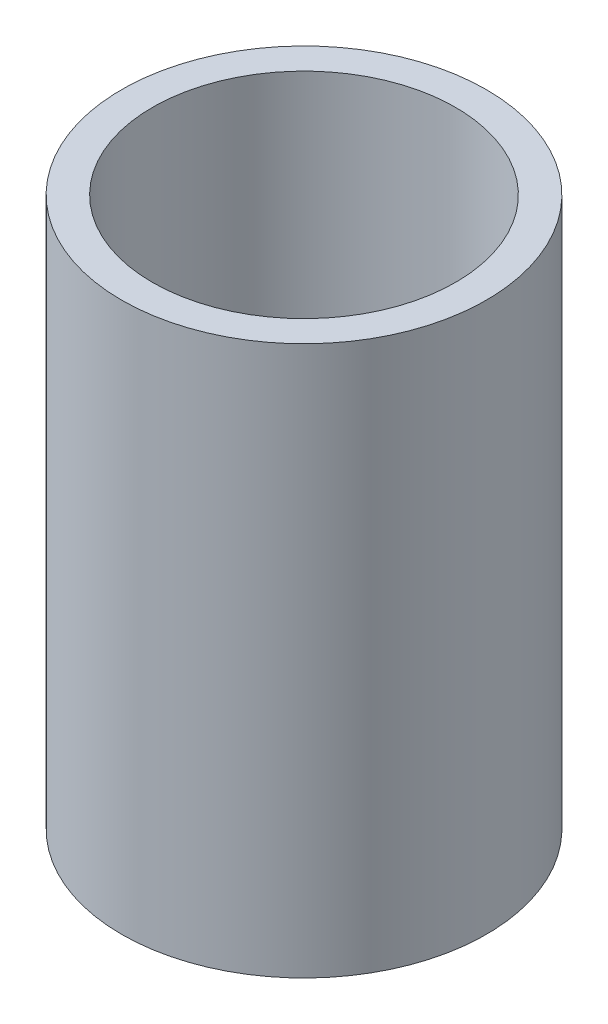
from build123d import *

# Parameters (mm, degrees)
SKETCH1_R           = 21.082
SKETCH1_R_2         = 17.526
BOSS_EXTRUDE1_DEPTH = 63.5


with BuildPart() as part:
    # Sketch1 → Boss-Extrude1 (new body)
    with BuildSketch(Plane(origin=(0, 0, 0), x_dir=(1, 0, 0), z_dir=(0, 1, 0))):
        with Locations(Location((0, 0, 0), (0, 0, 270))):
            Circle(SKETCH1_R)
        with Locations(Location((0, 0, 0), (0, 0, 270))):
            Circle(SKETCH1_R_2, mode=Mode.SUBTRACT)
    extrude(amount=BOSS_EXTRUDE1_DEPTH)


solid = part.part
